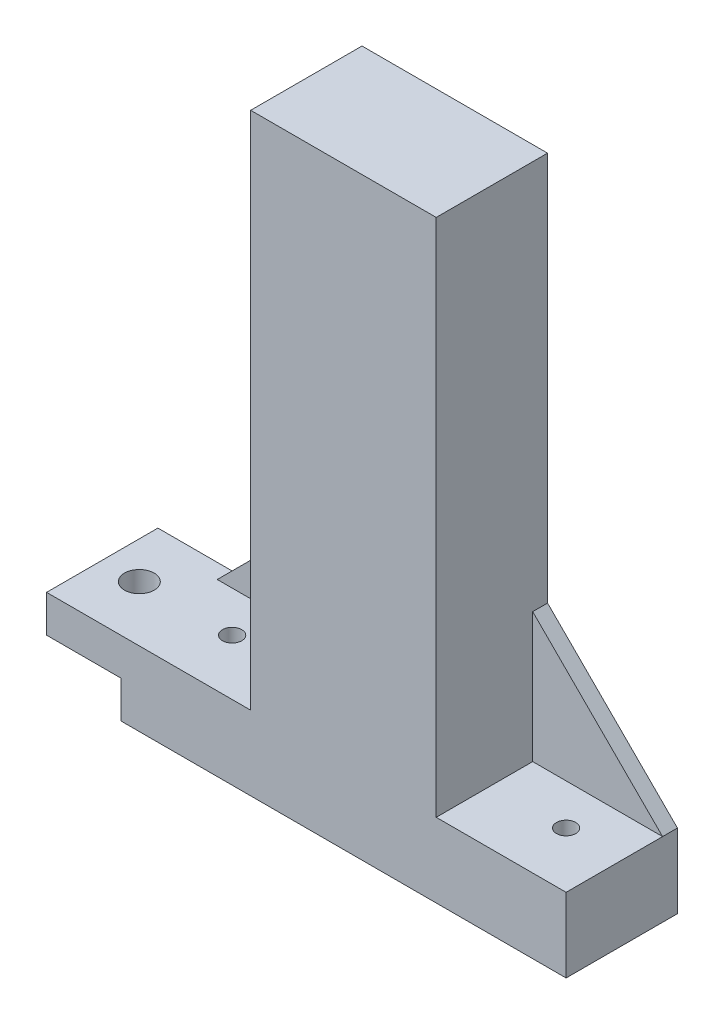
from build123d import *

# Parameters (mm, degrees)
SKETCH_2_W          = 60
SKETCH_2_H          = 15
SKETCH_2_R          = 1.3
EXTRUDE_1_DEPTH     = 10
SKETCH_3_W          = 25
SKETCH_3_H          = 15
EXTRUDE_2_DEPTH     = 70
EXTRUDE_3_DEPTH     = 2
SKETCH_6_W          = 10
SKETCH_6_H          = 5
EXTRUDE_4_DEPTH     = 15
SKETCH_7_R          = 2
CUT_EXTRUDE_1_DEPTH = 81.970673704


with BuildPart() as part:
    # 草圖2 → 填料-伸長1 (new body)
    with BuildSketch(Plane(origin=(0, 0, 0), x_dir=(1, 0, 0), z_dir=(0, 1, 0))):
        Rectangle(SKETCH_2_W, SKETCH_2_H)
        with Locations(Location((-22.5, 0, 0), (0, 0, 270))):
            Circle(SKETCH_2_R, mode=Mode.SUBTRACT)
        with Locations(Location((22.5, 0, 0), (0, 0, 90))):
            Circle(SKETCH_2_R, mode=Mode.SUBTRACT)
    extrude(amount=EXTRUDE_1_DEPTH)

    # 草圖3 → 填料-伸長2 (add)
    with BuildSketch(Plane(origin=(0, 10, 0), x_dir=(1, 0, 0), z_dir=(0, 1, 0))):
        Rectangle(SKETCH_3_W, SKETCH_3_H)
    extrude(amount=EXTRUDE_2_DEPTH)

    # 草圖5 → 填料-伸長3 (add)
    with BuildSketch(Plane(origin=(0, 0, -7.5), x_dir=(-1, 0, 0), z_dir=(0, 0, -1))):
        Polygon((-30, 10), (-12.5, 27.5), (-12.5, 10), align=None)
        Polygon((12.5, 27.5), (12.5, 10), (30, 10), align=None)
    extrude(amount=-EXTRUDE_3_DEPTH)

    # 草圖6 → 填料-伸長4 (add)
    with BuildSketch(Plane.XY.offset(7.5)):
        with Locations((-35, 7.5)):
            Rectangle(SKETCH_6_W, SKETCH_6_H)
    extrude(amount=-EXTRUDE_4_DEPTH)

    # 草圖7 → 除料-伸長1 (cut, through all)
    with BuildSketch(Plane(origin=(0, 10, 0), x_dir=(1, 0, 0), z_dir=(0, 1, 0))):
        with Locations(Location((-35, 0, 0), (0, 0, 270))):
            Circle(SKETCH_7_R)
    extrude(amount=-CUT_EXTRUDE_1_DEPTH, mode=Mode.SUBTRACT)


solid = part.part
